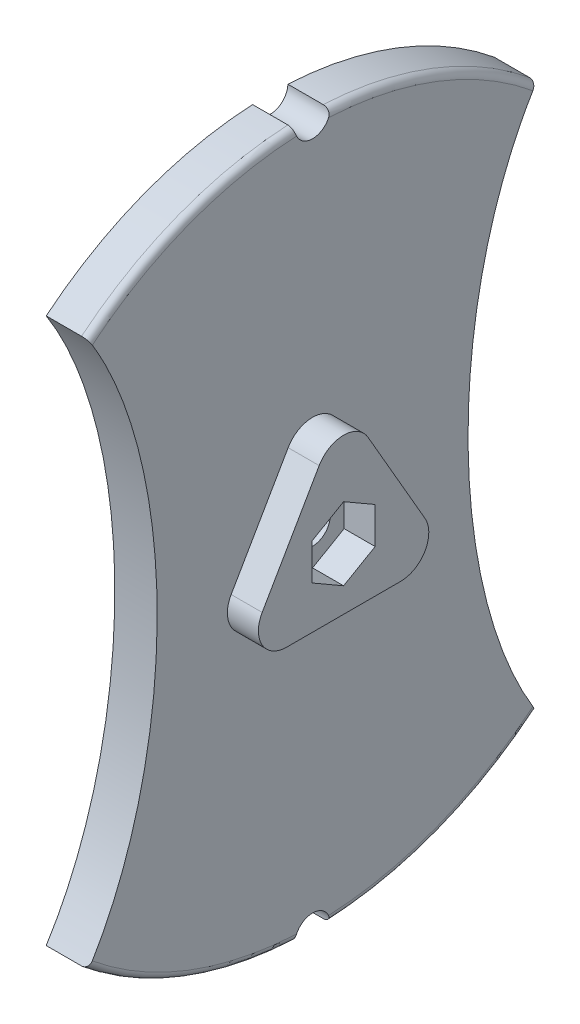
from build123d import *

# Parameters (mm, degrees)
SKETCH2_R           = 3.175
BOSS_EXTRUDE1_DEPTH = 7.62
BOSS_EXTRUDE2_DEPTH = 5.58
FILLET1_R           = 5.08
FILLET3_R           = 1.27
SKETCH4_RX          = 64.751719118
SKETCH4_RY          = 35.535243055
CUT_EXTRUDE1_DEPTH  = 8.89


with BuildPart() as part:
    # Sketch2 → Boss-Extrude1 (new body)
    with BuildSketch(Plane(origin=(0, 0, 0), x_dir=(0, 0, -1), z_dir=(1, 0, 0))):
        with BuildLine():
            ThreePointArc((3.174202727, -63.420615237), (63.5, 0), (3.174202727, 63.420615237))
            ThreePointArc((3.174202727, 63.420615237), (0.000185525, 60.324999039), (-3.173812636, 63.42063476))
            ThreePointArc((-3.173812636, 63.42063476), (-63.5, 0), (-3.173812636, -63.42063476))
            ThreePointArc((-3.173812636, -63.42063476), (0.000185525, -60.324999039), (3.174202727, -63.420615237))
        make_face()
        with Locations(Location((0, 0, 0), (0, 0, 180))):
            Circle(SKETCH2_R, mode=Mode.SUBTRACT)
    extrude(amount=BOSS_EXTRUDE1_DEPTH)

    # Sketch3 → Boss-Extrude2 (add)
    with BuildSketch(Plane(origin=(7.62, 0, 0), x_dir=(0, 0, -1), z_dir=(1, 0, 0))):
        Polygon((19.05, -10.998522628), (0, 21.997045256), (-19.05, -10.998522628), align=None)
        Polygon((-5.675, 3.276462778), (-5.675, -3.276462778), (0, -6.552925555), (5.675, -3.276462778), (5.675, 3.276462778), (0, 6.552925555), align=None, mode=Mode.SUBTRACT)
    extrude(amount=BOSS_EXTRUDE2_DEPTH)

    # Fillet1
    fillet1_edges = [part.edges().sort_by_distance(p)[0] for p in [
        (10.41, -10.998522628, 19.05),
        (10.41, -10.998522628, -19.05),
        (10.41, 21.997045256, 0),
    ]]
    fillet(fillet1_edges, radius=FILLET1_R)

    # Fillet3
    fillet3_edges = [part.edges().sort_by_distance(p)[0] for p in [
        (7.62, 0, -63.5),
        (7.62, 0, 63.5),
    ]]
    fillet(fillet3_edges, radius=FILLET3_R)

    # Sketch4 → Cut-Extrude1 (cut)
    with BuildSketch(Plane.ZY):
        with Locations(Location((-63.5, 0), (0, 0, -90))):
            Ellipse(SKETCH4_RX, SKETCH4_RY)
    cut_extrude1 = extrude(amount=-CUT_EXTRUDE1_DEPTH, mode=Mode.SUBTRACT)

    # Mirror1: Cut-Extrude1 across plane
    add(cut_extrude1.mirror(Plane.XY), mode=Mode.SUBTRACT)


solid = part.part
